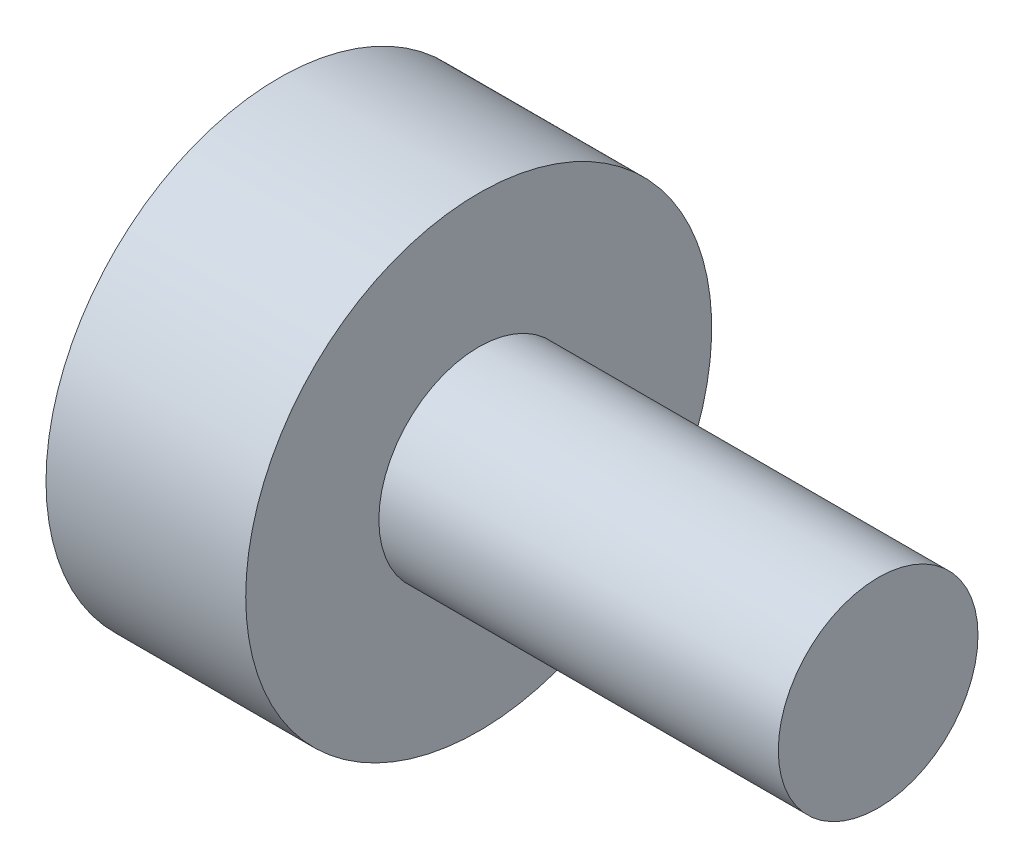
from build123d import *

# Parameters (mm, degrees)
SKETCH_2_R          = 5
CUT_EXTRUDE_1_DEPTH = 20
SKETCH_3_R          = 9
CUT_EXTRUDE_2_DEPTH = 5
CUT_EXTRUDE_2_TAPER = 38.659808254


with BuildPart() as part:
    # Эскиз1 → Повернуть1 (revolve)
    with BuildSketch(Plane.XY, mode=Mode.PRIVATE) as revolve_1_sk:
        Polygon((0, 0), (100, 0), (100, 15), (40, 15), (40, 35), (10, 35), (10, 20), (0, 20), align=None)
    revolve(revolve_1_sk.sketch.rotate(Axis((0, 0, 0), (1, 0, 0)), 90), axis=Axis((0, 0, 0), (1, 0, 0)))

    # Эскиз2 → Вырез-Вытянуть1 (cut)
    with BuildSketch(Plane(origin=(0, 0, 0), x_dir=(0, 0, -1), z_dir=(1, 0, 0))):
        Circle(SKETCH_2_R)
    extrude(amount=CUT_EXTRUDE_1_DEPTH, mode=Mode.SUBTRACT)

    # Эскиз3 → Вырез-Вытянуть2 (cut)
    with BuildSketch(Plane(origin=(0, 0, 0), x_dir=(0, 0, -1), z_dir=(1, 0, 0))):
        Circle(SKETCH_3_R)
    extrude(amount=CUT_EXTRUDE_2_DEPTH, taper=CUT_EXTRUDE_2_TAPER, mode=Mode.SUBTRACT)


solid = part.part
